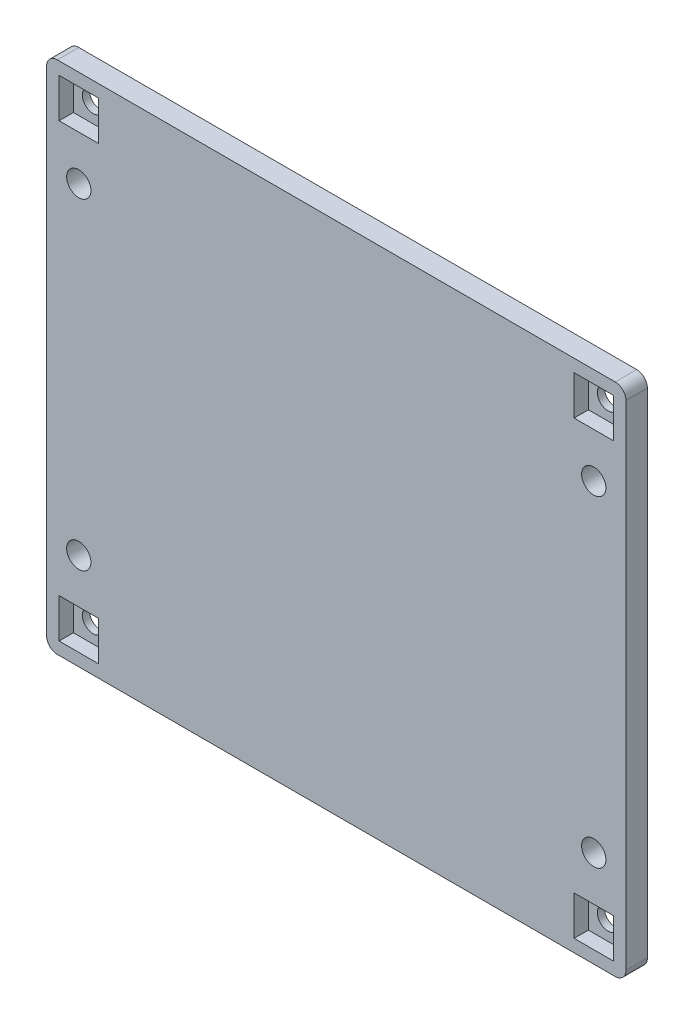
from build123d import *

# Parameters (mm, degrees)
MODEL_R                 = 1.5
MODEL_R_2               = 1.7
SALIENTE_EXTRUIR1_DEPTH = 3
CROQUIS2_W              = 5.5
CROQUIS2_H              = 5.5
CORTAR_EXTRUIR1_DEPTH   = 2


with BuildPart() as part:
    # Model → Saliente-Extruir1 (new body)
    with BuildSketch(Plane.XY):
        with BuildLine():
            Line((85.482701858, 227.246277544), (7.478092, 227.246277544))
            ThreePointArc((7.478092, 227.246277544), (6.417431828, 227.685617372), (5.978092, 228.746277544))
            Line((5.978092, 228.746277544), (5.978092, 297.748681778))
            ThreePointArc((5.978092, 297.748681778), (6.417431828, 298.80934195), (7.478092, 299.248681778))
            Line((7.478092, 299.248681778), (85.482701858, 299.248681778))
            ThreePointArc((85.482701858, 299.248681778), (86.54336203, 298.80934195), (86.982701858, 297.748681778))
            Line((86.982701858, 297.748681778), (86.982701858, 228.746277544))
            ThreePointArc((86.982701858, 228.746277544), (86.54336203, 227.685617372), (85.482701858, 227.246277544))
        make_face()
        with Locations((82.48303636, 294.748681778)):
            Circle(MODEL_R, mode=Mode.SUBTRACT)
        with Locations((10.478092, 231.745943042)):
            Circle(MODEL_R, mode=Mode.SUBTRACT)
        with Locations((82.48303636, 231.745943042)):
            Circle(MODEL_R, mode=Mode.SUBTRACT)
        with Locations((10.478092, 294.748681778)):
            Circle(MODEL_R, mode=Mode.SUBTRACT)
        with Locations((10.478092, 240.74560854)):
            Circle(MODEL_R_2, mode=Mode.SUBTRACT)
        with Locations((10.478092, 285.74901628)):
            Circle(MODEL_R_2, mode=Mode.SUBTRACT)
        with Locations((82.48303636, 240.74560854)):
            Circle(MODEL_R_2, mode=Mode.SUBTRACT)
        with Locations((82.48303636, 285.74901628)):
            Circle(MODEL_R_2, mode=Mode.SUBTRACT)
    extrude(amount=SALIENTE_EXTRUIR1_DEPTH)

    # Croquis2 → Cortar-Extruir1 (cut)
    with BuildSketch(Plane.XY.offset(3)):
        with Locations((10.478092, 294.748681778)):
            Rectangle(CROQUIS2_W, CROQUIS2_H)
        with Locations((82.48303636, 294.748681778)):
            Rectangle(CROQUIS2_W, CROQUIS2_H)
        with Locations((10.478092, 231.745943042)):
            Rectangle(CROQUIS2_W, CROQUIS2_H)
        with Locations((82.48303636, 231.745943042)):
            Rectangle(CROQUIS2_W, CROQUIS2_H)
    extrude(amount=-CORTAR_EXTRUIR1_DEPTH, mode=Mode.SUBTRACT)


solid = part.part
